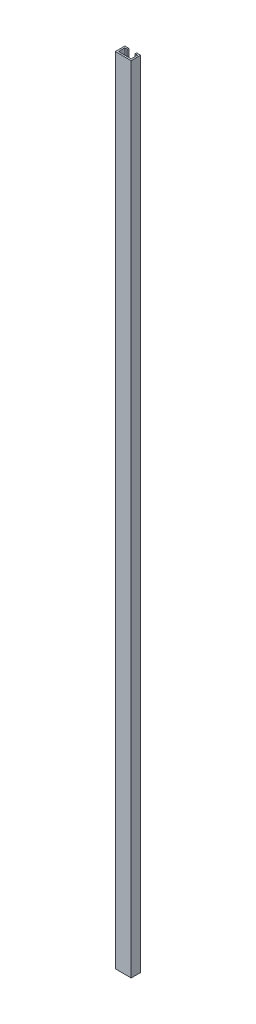
from build123d import *

# Parameters (mm, degrees)
EXTRUDE_1_DEPTH = 500


with BuildPart() as part:
    # 草图1 → 凸台-拉伸1 (new body)
    with BuildSketch(Plane(origin=(0, 0, 0), x_dir=(1, 0, 0), z_dir=(0, 1, 0))):
        Polygon((0, -6), (10, -6), (10, 0), (7.5, 0), (7.5, -1), (9, -1), (9, -5), (1, -5), (1, -1), (2.5, -1), (2.5, 0), (0, 0), align=None)
    extrude(amount=EXTRUDE_1_DEPTH)


solid = part.part
